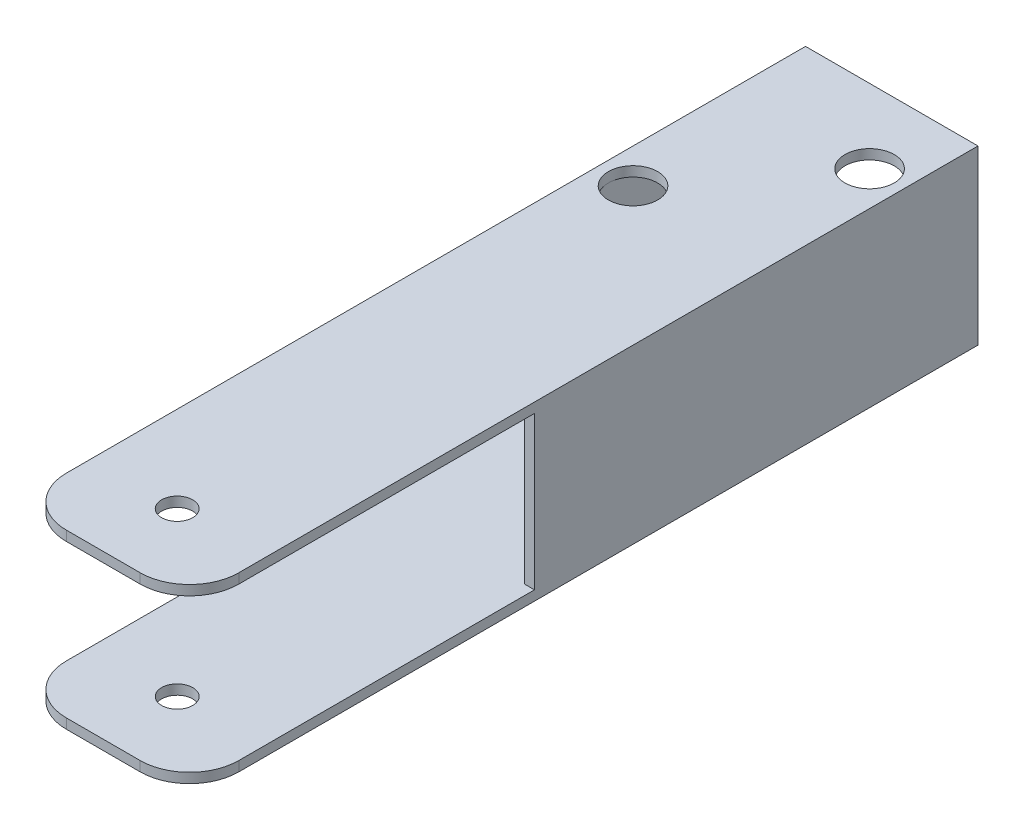
from build123d import *

# Parameters (mm, degrees)
SKIZZE1_W                       = 35
SKIZZE1_H                       = 35
SKIZZE1_W_2                     = 31
SKIZZE1_H_2                     = 31
AUFSATZ_LINEAR_AUSTRAGEN1_DEPTH = 185
SKIZZE6_W                       = 70
SKIZZE6_H                       = 31
SCHNITT_LINEAR_AUSTRAGEN1_DEPTH = 190.093230974
SKIZZE7_R                       = 3.15
SCHNITT_LINEAR_AUSTRAGEN2_DEPTH = 190.093230974
VERRUNDUNG1_R                   = 10
SKIZZE10_W                      = 39.330921978
SKIZZE10_H                      = 37.025640666
SCHNITT_LINEAR_AUSTRAGEN3_DEPTH = 25
SKIZZE11_R                      = 5
SCHNITT_LINEAR_AUSTRAGEN4_DEPTH = 190.093230974


with BuildPart() as part:
    # Skizze1 → Aufsatz-Linear austragen1 (new body)
    with BuildSketch(Plane.XY):
        Rectangle(SKIZZE1_W, SKIZZE1_H)
        Rectangle(SKIZZE1_W_2, SKIZZE1_H_2, mode=Mode.SUBTRACT)
    extrude(amount=AUFSATZ_LINEAR_AUSTRAGEN1_DEPTH)

    # Skizze6 → Schnitt-Linear austragen1 (cut, through all)
    with BuildSketch(Plane(origin=(17.5, 0, 0), x_dir=(0, 0, -1), z_dir=(1, 0, 0))):
        with Locations((-150, 0)):
            Rectangle(SKIZZE6_W, SKIZZE6_H)
    extrude(amount=-SCHNITT_LINEAR_AUSTRAGEN1_DEPTH, mode=Mode.SUBTRACT)

    # Skizze7 → Schnitt-Linear austragen2 (cut, through all)
    with BuildSketch(Plane.XZ.offset(17.5)):
        with Locations(Location((0, 170, 0), (0, 0, 270))):
            Circle(SKIZZE7_R)
    extrude(amount=-SCHNITT_LINEAR_AUSTRAGEN2_DEPTH, mode=Mode.SUBTRACT)

    # Verrundung1
    verrundung1_edges = [part.edges().sort_by_distance(p)[0] for p in [
        (-17.5, 16.5, 185),
        (-17.5, -16.5, 185),
        (17.5, 16.5, 185),
        (17.5, -16.5, 185),
    ]]
    fillet(verrundung1_edges, radius=VERRUNDUNG1_R)

    # Skizze10 → Schnitt-Linear austragen3 (cut)
    with BuildSketch(Plane(origin=(0, 0, 0), x_dir=(-1, 0, 0), z_dir=(0, 0, -1))):
        Rectangle(SKIZZE10_W, SKIZZE10_H)
    extrude(amount=-SCHNITT_LINEAR_AUSTRAGEN3_DEPTH, mode=Mode.SUBTRACT)

    # Skizze11 → Schnitt-Linear austragen4 (cut, through all)
    with BuildSketch(Plane(origin=(0, 17.5, 0), x_dir=(1, 0, 0), z_dir=(0, 1, 0))):
        with Locations(Location((10.5, -40, 0), (0, 0, 270))):
            Circle(SKIZZE11_R)
        with Locations(Location((-10.5, -67, 0), (0, 0, 270))):
            Circle(SKIZZE11_R)
    extrude(amount=-SCHNITT_LINEAR_AUSTRAGEN4_DEPTH, mode=Mode.SUBTRACT)


solid = part.part
